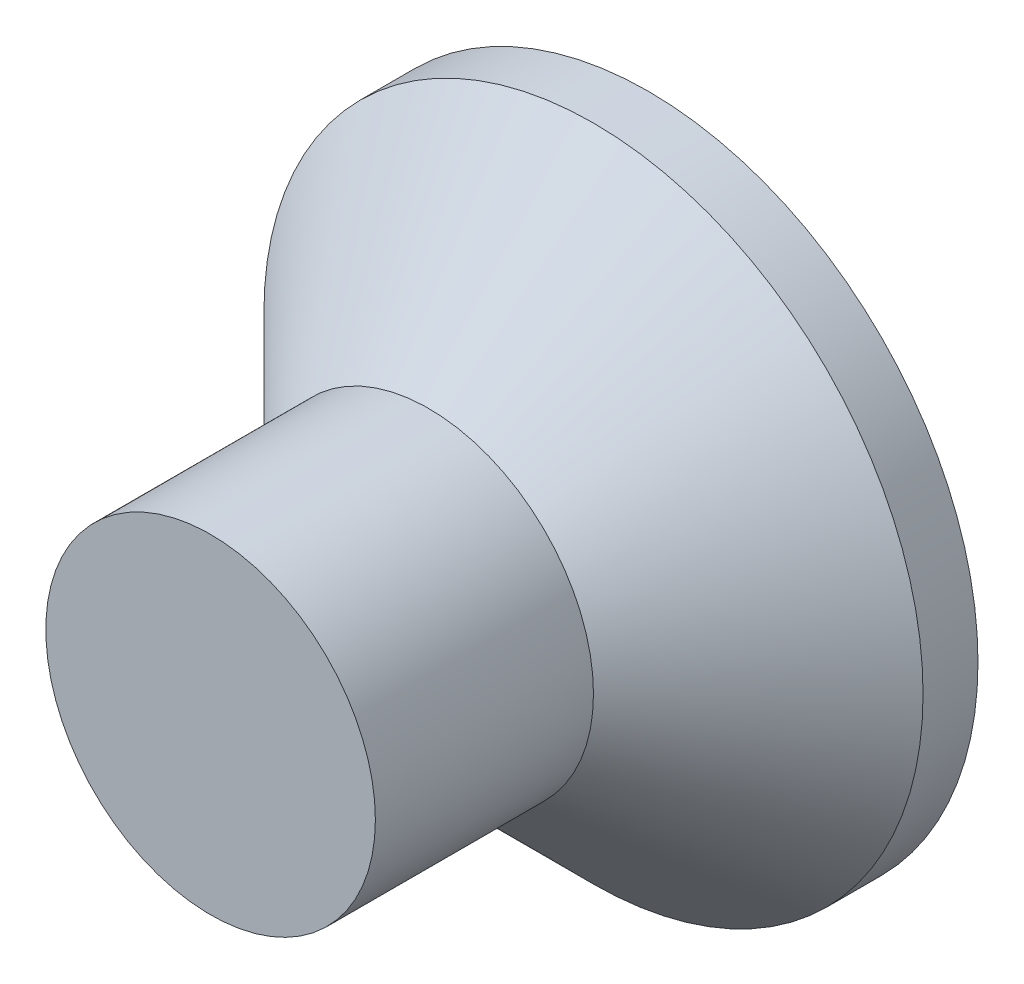
from build123d import *

# Parameters (mm, degrees)
CUT_EXTRUDE1_DEPTH = 1
CHAMFER1_SIZE      = 0.3


with BuildPart() as part:
    # Sketch1 → Revolve1 (revolve)
    with BuildSketch(Plane(origin=(0, 0, 0), x_dir=(1, 0, 0), z_dir=(0, 1, 0))):
        with BuildLine():
            Line((3, 0), (3, -0.5))
            Line((3, -0.5), (1.5, -2))
            Line((1.5, -2), (1.5, -3.985079935))
            Line((1.5, -3.985079935), (0, -3.985079935))
            Line((0, -3.985079935), (0, 0.619607068))
            ThreePointArc((0, 0.619607068), (1.531658653, 0.463087711), (3, 0))
        make_face()
    revolve(axis=Axis((0, 0, 3.985079935), (0, 0, -1)))

    # Sketch2 → Cut-Extrude1 (cut)
    with BuildSketch(Plane.XY.offset(-0.619607068)):
        Polygon((1.5, 0), (0.75, 1.299038106), (-0.75, 1.299038106), (-1.5, 0), (-0.75, -1.299038106), (0.75, -1.299038106), align=None)
    extrude(amount=CUT_EXTRUDE1_DEPTH, mode=Mode.SUBTRACT)

    # Chamfer1
    chamfer1_edges = [part.edges().sort_by_distance(p)[0] for p in [
        (1.125, -0.649519053, 0.380392932),
        (1.125, 0.649519053, 0.380392932),
        (0, 1.299038106, 0.380392932),
        (-1.125, 0.649519053, 0.380392932),
        (-1.125, -0.649519053, 0.380392932),
        (0, -1.299038106, 0.380392932),
    ]]
    chamfer(chamfer1_edges, length=CHAMFER1_SIZE)


solid = part.part
